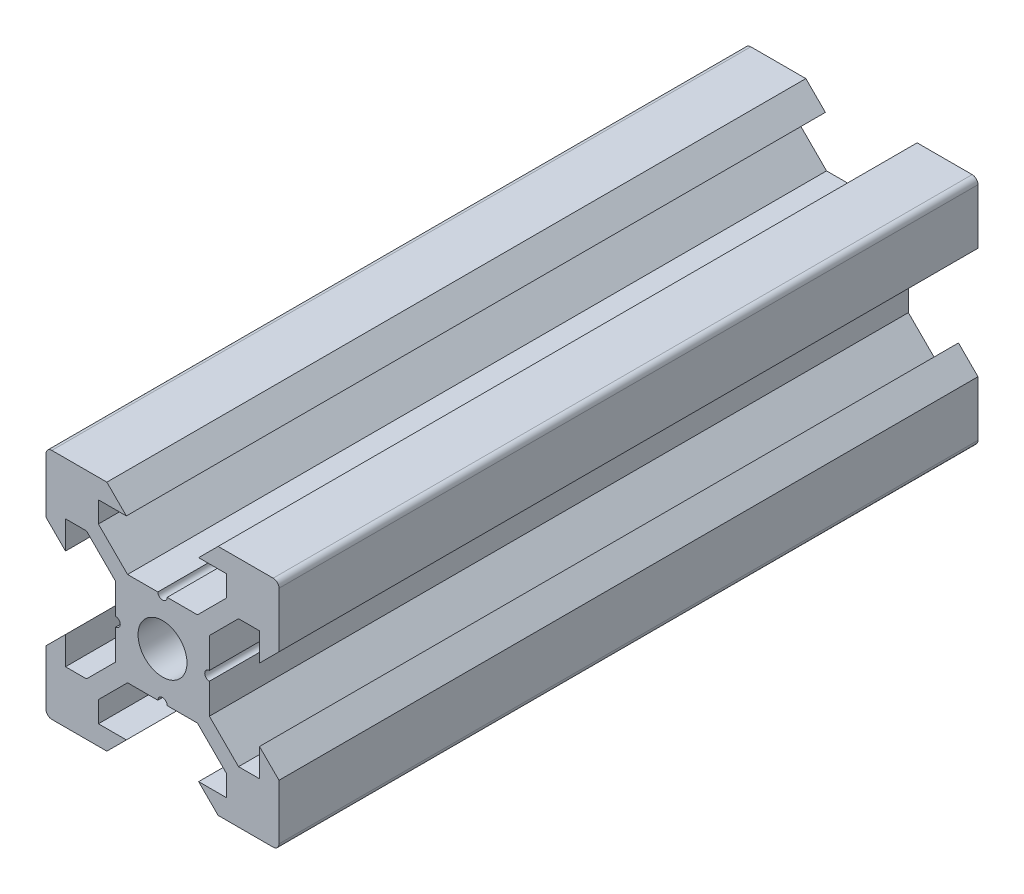
from build123d import *

# Parameters (mm, degrees)
SKETCH1_R           = 2.1
BOSS_EXTRUDE1_DEPTH = 60
FILLET1_R           = 0.5
CUT_EXTRUDE1_DEPTH  = 62.64414003


with BuildPart() as part:
    # Sketch1 → Boss-Extrude1 (new body)
    with BuildSketch(Plane.XY):
        Polygon((-10, 10), (-4.775, 10), (-3.1, 8.325), (-5.5, 8.325), (-5.5, 6.525), (-3, 4.025), (3, 4.025), (5.5, 6.525), (5.5, 8.325), (3.1, 8.325), (4.775, 10), (10, 10), (10, 4.775), (8.325, 3.1), (8.325, 5.5), (6.525, 5.5), (4.025, 3), (4.025, -3), (6.525, -5.5), (8.325, -5.5), (8.325, -3.1), (10, -4.775), (10, -10), (4.775, -10), (3.1, -8.325), (5.5, -8.325), (5.5, -6.525), (3, -4.025), (-3, -4.025), (-5.5, -6.525), (-5.5, -8.325), (-3.1, -8.325), (-4.775, -10), (-10, -10), (-10, -4.775), (-8.325, -3.1), (-8.325, -5.5), (-6.525, -5.5), (-4.025, -3), (-4.025, 3), (-6.525, 5.5), (-8.325, 5.5), (-8.325, 3.1), (-10, 4.775), align=None)
        Circle(SKETCH1_R, mode=Mode.SUBTRACT)
    extrude(amount=BOSS_EXTRUDE1_DEPTH)

    # Fillet1
    fillet1_edges = [part.edges().sort_by_distance(p)[0] for p in [
        (10, -10, 30),
        (-10, -10, 30),
        (-10, 10, 30),
        (10, 10, 30),
    ]]
    fillet(fillet1_edges, radius=FILLET1_R)

    # Sketch2 → Cut-Extrude1 (cut, through all)
    with BuildSketch(Plane.XY.offset(60)):
        with BuildLine():
            ThreePointArc((-4.025, 0.4), (-4.425, 0), (-4.025, -0.4))
            Line((-4.025, -0.4), (-4.025, 0.4))
        make_face()
        with BuildLine():
            Line((-4.025, 0.4), (-4.025, -0.4))
            ThreePointArc((-4.025, -0.4), (-3.742157288, -0.282842712), (-3.625, 0))
            ThreePointArc((-3.625, 0), (-3.742157288, 0.282842712), (-4.025, 0.4))
        make_face()
        with BuildLine():
            ThreePointArc((0.4, 4.025), (0, 4.425), (-0.4, 4.025))
            Line((-0.4, 4.025), (0.4, 4.025))
        make_face()
        with BuildLine():
            Line((0.4, 4.025), (-0.4, 4.025))
            ThreePointArc((-0.4, 4.025), (0, 3.625), (0.4, 4.025))
        make_face()
        with BuildLine():
            ThreePointArc((4.025, 0.4), (3.625, 0), (4.025, -0.4))
            Line((4.025, -0.4), (4.025, 0.4))
        make_face()
        with BuildLine():
            Line((4.025, 0.4), (4.025, -0.4))
            ThreePointArc((4.025, -0.4), (4.307842712, -0.282842712), (4.425, 0))
            ThreePointArc((4.425, 0), (4.307842712, 0.282842712), (4.025, 0.4))
        make_face()
        with BuildLine():
            ThreePointArc((0.4, -4.025), (0, -3.625), (-0.4, -4.025))
            Line((-0.4, -4.025), (0.4, -4.025))
        make_face()
        with BuildLine():
            Line((0.4, -4.025), (-0.4, -4.025))
            ThreePointArc((-0.4, -4.025), (0, -4.425), (0.4, -4.025))
        make_face()
    extrude(amount=-CUT_EXTRUDE1_DEPTH, mode=Mode.SUBTRACT)


solid = part.part
